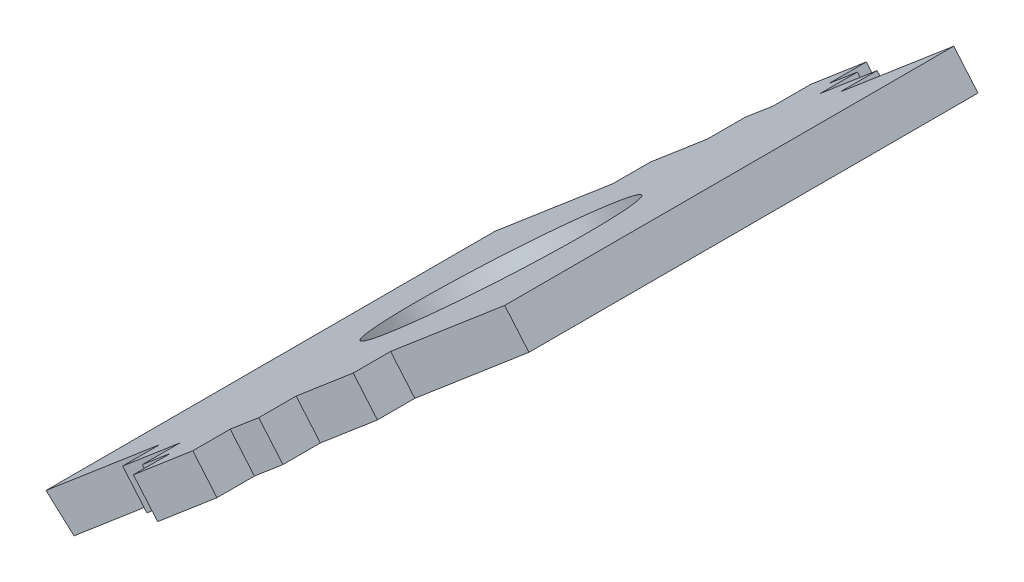
from build123d import *

# Parameters (mm, degrees)
BOSS_EXTRUDE1_DEPTH      = 47.625
BOSS_EXTRUDE1_DEPTH_BACK = 9.525
SKETCH2_R                = 9.525
CUT_EXTRUDE1_DEPTH       = 122.738617419


with BuildPart() as part:
    # Sketch1 → Boss-Extrude1 (new, two sides: drawn at the far end of the back side and taken through both)
    with BuildSketch(Plane.XY.offset(-BOSS_EXTRUDE1_DEPTH_BACK)):
        Polygon((-104.425717212, 293.558329543), (-143.022728413, 260.774121234), (-145.397980675, 262.922347723), (-106.481154517, 295.978206086), align=None)
    extrude(amount=BOSS_EXTRUDE1_DEPTH + BOSS_EXTRUDE1_DEPTH_BACK)

    # Sketch2 → Cut-Extrude1 (cut, through all)
    with BuildSketch(Plane(origin=(-188.610450601, 222.052019857, 0), x_dir=(0.762165840447724, 0.6473818283321017, 0), z_dir=(0.6473818283321017, -0.762165840447724, 0))):
        with Locations((85.054613578, 19.05)):
            Circle(SKETCH2_R)
        Polygon((110.454613578, -9.525), (88.229613578, -9.525), (88.229613578, -6.349999999), (91.404613578, -6.349999999), (91.404613578, -3.175), (97.754613578, -3.175), (97.754613578, 0), (110.454613578, 0), (113.679871945, 0), (113.679871945, -9.525), align=None)
        Polygon((59.813389382, -9.525), (82.038389382, -9.525), (82.038389382, -6.349999999), (78.863389382, -6.349999999), (78.863389382, -3.175), (72.513389382, -3.175), (72.513389382, 0), (59.813389382, 0), (54.830807426, 0), (54.830807426, -9.525), align=None)
        Polygon((110.454613578, 38.1), (118.192353476, 38.1), (118.192353476, 47.625), (110.454613578, 47.625), (88.229613578, 47.625), (88.229613578, 44.449999999), (91.404613578, 44.449999999), (91.404613578, 41.275), (97.754613578, 41.275), (97.754613578, 38.1), align=None)
        Polygon((59.393776038, 38.1), (50.339137781, 38.1), (50.339137781, 47.625), (59.393776038, 47.625), (81.618776038, 47.625), (81.618776038, 44.449999999), (78.443776038, 44.449999999), (78.443776038, 41.275), (72.093776038, 41.275), (72.093776038, 38.1), align=None)
    extrude(amount=-CUT_EXTRUDE1_DEPTH, mode=Mode.SUBTRACT)


solid = part.part
